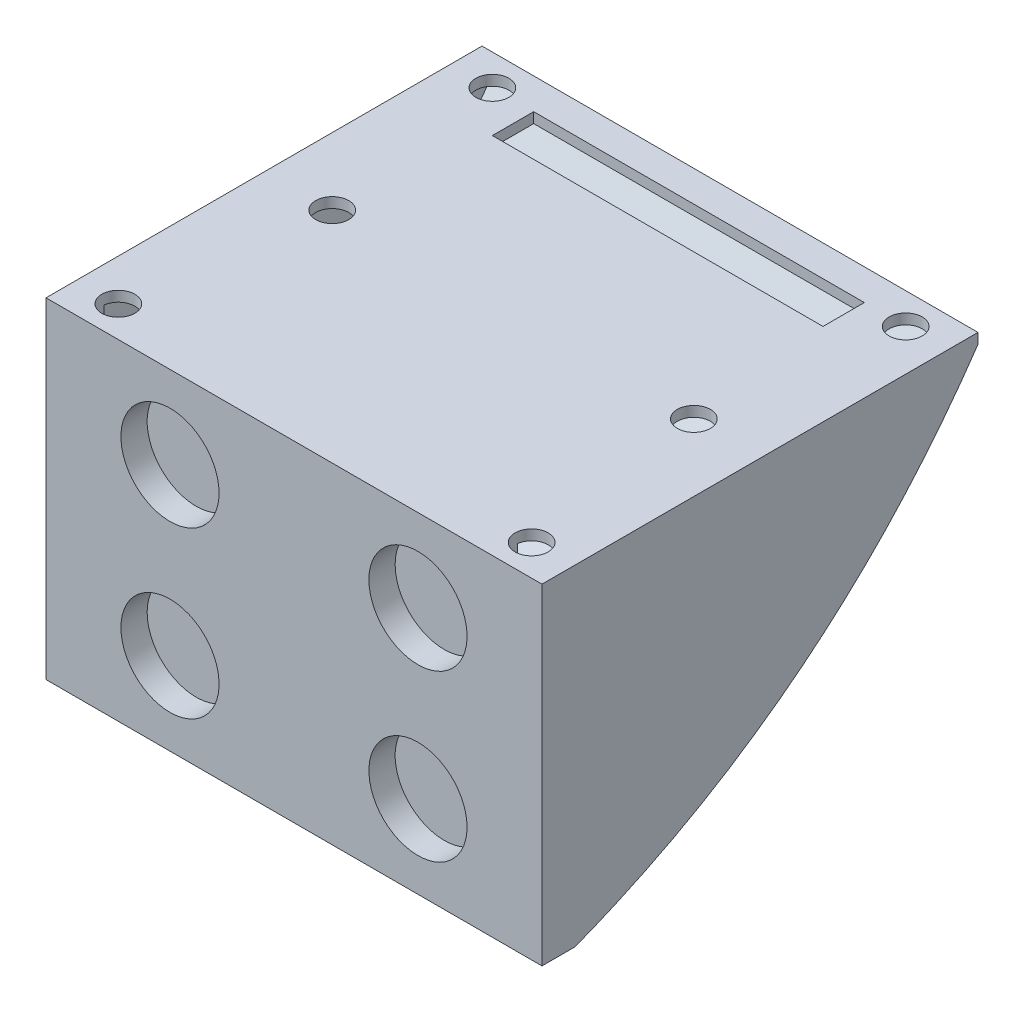
from build123d import *

# Parameters (mm, degrees)
CROQUIS1_W                        = 48
CROQUIS1_H                        = 32
SALIENTE_EXTRUIR1_DEPTH           = 3.2
CROQUIS2_W                        = 48
CROQUIS2_H                        = 1
SALIENTE_EXTRUIR2_DEPTH           = 39
TALADRO_DE_MARGEN_PARA_M31_D      = 3.2
SALIENTE_EXTRUIR3_DEPTH           = 48
CORTAR_EXTRUIR1_DEPTH             = 46
CORTAR_EXTRUIR2_REACH             = 71.635
CROQUIS7_W                        = 44
CROQUIS7_H                        = 14
SALIENTE_EXTRUIR4_DEPTH           = 2
CORTAR_EXTRUIR3_REACH             = 71.635
CROQUIS9_W                        = 32
CROQUIS9_H                        = 4
CROQUIS10_R                       = 4.75
CORTAR_EXTRUIR4_DEPTH             = 2.54
TALADRO_DE_MARGEN_PARA_M32_REACH  = 69.057
TALADRO_DE_MARGEN_PARA_M32_BORE_R = 1.6


with BuildPart() as part:
    # Croquis1 → Saliente-Extruir1 (new body)
    with BuildSketch(Plane.XY):
        with Locations((24, 16)):
            Rectangle(CROQUIS1_W, CROQUIS1_H)
    extrude(amount=SALIENTE_EXTRUIR1_DEPTH)

    # Croquis2 → Saliente-Extruir2 (add)
    with BuildSketch(Plane(origin=(0, 0, 0), x_dir=(-1, 0, 0), z_dir=(0, 0, -1))):
        with Locations((-24, 31.5)):
            Rectangle(CROQUIS2_W, CROQUIS2_H)
    extrude(amount=SALIENTE_EXTRUIR2_DEPTH)

    # Taladro de margen para M31 (through all)
    with Locations(Plane(origin=(6.5, 32, -18), x_dir=(0, 0, 1), z_dir=(0, 1, 0))):
        with Locations((0, 0), (0, 35)):
            Hole(TALADRO_DE_MARGEN_PARA_M31_D / 2)

    # Croquis5 → Saliente-Extruir3 (add)
    with BuildSketch(Plane.ZY):
        with BuildLine():
            Line((0, 0), (0, 31))
            Line((0, 31), (-39, 31))
            add(Edge.make_bspline(
                [(-39, 31), (-24.225246719, 9.372950474), (0, 0)],
                knots=[0, 0, 0, 1, 1, 1], degree=2))
        make_face()
    extrude(amount=-SALIENTE_EXTRUIR3_DEPTH)

    # Croquis6 → Cortar-Extruir1 (cut)
    with BuildSketch(Plane.ZY):
        with BuildLine():
            Line((0, 31), (-38, 31))
            add(Edge.make_bspline(
                [(-38, 31), (-22.667891875, 11.302250625), (0, 1)],
                knots=[0, 0, 0, 1, 1, 1], degree=2))
            Line((0, 1), (0, 31))
        make_face()
    extrude(amount=-CORTAR_EXTRUIR1_DEPTH, mode=Mode.SUBTRACT)

    # Croquis7 → Cortar-Extruir2 (cut, up to next)
    with BuildSketch(Plane.XZ, mode=Mode.PRIVATE) as cortar_extruir2_sk1:
        with Locations((24, -7)):
            Rectangle(CROQUIS7_W, CROQUIS7_H)
    cortar_extruir2_tool1 = extrude(cortar_extruir2_sk1.sketch, amount=-CORTAR_EXTRUIR2_REACH, mode=Mode.PRIVATE) & part.part
    add(cortar_extruir2_tool1.solids().sort_by_distance((24, 0, -7))[0], mode=Mode.SUBTRACT)

    # Croquis8 → Saliente-Extruir4 (add)
    with BuildSketch(Plane.ZY):
        with BuildLine():
            Line((-38, 31), (0, 31))
            Line((0, 31), (0, 1))
            add(Edge.make_bspline(
                [(-38, 31), (-22.667891875, 11.302250625), (0, 1)],
                knots=[0, 0, 0, 1, 1, 1], degree=2))
        make_face()
    extrude(amount=-SALIENTE_EXTRUIR4_DEPTH)

    # Croquis9 → Cortar-Extruir3 (cut, up to next)
    with BuildSketch(Plane(origin=(0, 32, 0), x_dir=(1, 0, 0), z_dir=(0, 1, 0)), mode=Mode.PRIVATE) as cortar_extruir3_sk1:
        with Locations((24, 34)):
            Rectangle(CROQUIS9_W, CROQUIS9_H)
    cortar_extruir3_tool1 = extrude(cortar_extruir3_sk1.sketch, amount=-CORTAR_EXTRUIR3_REACH, mode=Mode.PRIVATE) & part.part
    add(cortar_extruir3_tool1.solids().sort_by_distance((24, 32, -34))[0], mode=Mode.SUBTRACT)

    # Croquis10 → Cortar-Extruir4 (cut)
    with BuildSketch(Plane.XY.offset(3.2)):
        with Locations((12, 24)):
            Circle(CROQUIS10_R)
        with Locations(Location((36, 24, 0), (0, 0, 180))):
            Circle(CROQUIS10_R)
        with Locations((36, 8)):
            Circle(CROQUIS10_R)
        with Locations(Location((12, 8, 0), (0, 0, 180))):
            Circle(CROQUIS10_R)
    extrude(amount=-CORTAR_EXTRUIR4_DEPTH, mode=Mode.SUBTRACT)

    # Taladro de margen para M32 bore (on position points) → Taladro de margen para M32 (cut, up to next)
    with BuildSketch(Plane(origin=(4, 32, -36), x_dir=(0, 0, 1), z_dir=(0, 1, 0)), mode=Mode.PRIVATE) as taladro_de_margen_para_m32_sk1:
        Circle(TALADRO_DE_MARGEN_PARA_M32_BORE_R)
    taladro_de_margen_para_m32_tool1 = extrude(taladro_de_margen_para_m32_sk1.sketch, amount=-TALADRO_DE_MARGEN_PARA_M32_REACH, mode=Mode.PRIVATE) & part.part
    # Taladro de margen para M32 bore (on position points) → Taladro de margen para M32 (cut, up to next)
    with BuildSketch(Plane(origin=(4, 32, -36), x_dir=(0, 0, 1), z_dir=(0, 1, 0)), mode=Mode.PRIVATE) as taladro_de_margen_para_m32_sk2:
        with Locations((36.2, 0)):
            Circle(TALADRO_DE_MARGEN_PARA_M32_BORE_R)
    taladro_de_margen_para_m32_tool2 = extrude(taladro_de_margen_para_m32_sk2.sketch, amount=-TALADRO_DE_MARGEN_PARA_M32_REACH, mode=Mode.PRIVATE) & part.part
    # Taladro de margen para M32 bore (on position points) → Taladro de margen para M32 (cut, up to next)
    with BuildSketch(Plane(origin=(4, 32, -36), x_dir=(0, 0, 1), z_dir=(0, 1, 0)), mode=Mode.PRIVATE) as taladro_de_margen_para_m32_sk3:
        with Locations((36.2, 40)):
            Circle(TALADRO_DE_MARGEN_PARA_M32_BORE_R)
    taladro_de_margen_para_m32_tool3 = extrude(taladro_de_margen_para_m32_sk3.sketch, amount=-TALADRO_DE_MARGEN_PARA_M32_REACH, mode=Mode.PRIVATE) & part.part
    # Taladro de margen para M32 bore (on position points) → Taladro de margen para M32 (cut, up to next)
    with BuildSketch(Plane(origin=(4, 32, -36), x_dir=(0, 0, 1), z_dir=(0, 1, 0)), mode=Mode.PRIVATE) as taladro_de_margen_para_m32_sk4:
        with Locations((0, 40)):
            Circle(TALADRO_DE_MARGEN_PARA_M32_BORE_R)
    taladro_de_margen_para_m32_tool4 = extrude(taladro_de_margen_para_m32_sk4.sketch, amount=-TALADRO_DE_MARGEN_PARA_M32_REACH, mode=Mode.PRIVATE) & part.part
    add(taladro_de_margen_para_m32_tool1.solids().sort_by_distance((4, 32, -36))[0], mode=Mode.SUBTRACT)
    add(taladro_de_margen_para_m32_tool2.solids().sort_by_distance((4, 32, 0.2))[0], mode=Mode.SUBTRACT)
    add(taladro_de_margen_para_m32_tool3.solids().sort_by_distance((44, 32, 0.2))[0], mode=Mode.SUBTRACT)
    add(taladro_de_margen_para_m32_tool4.solids().sort_by_distance((44, 32, -36))[0], mode=Mode.SUBTRACT)


solid = part.part
